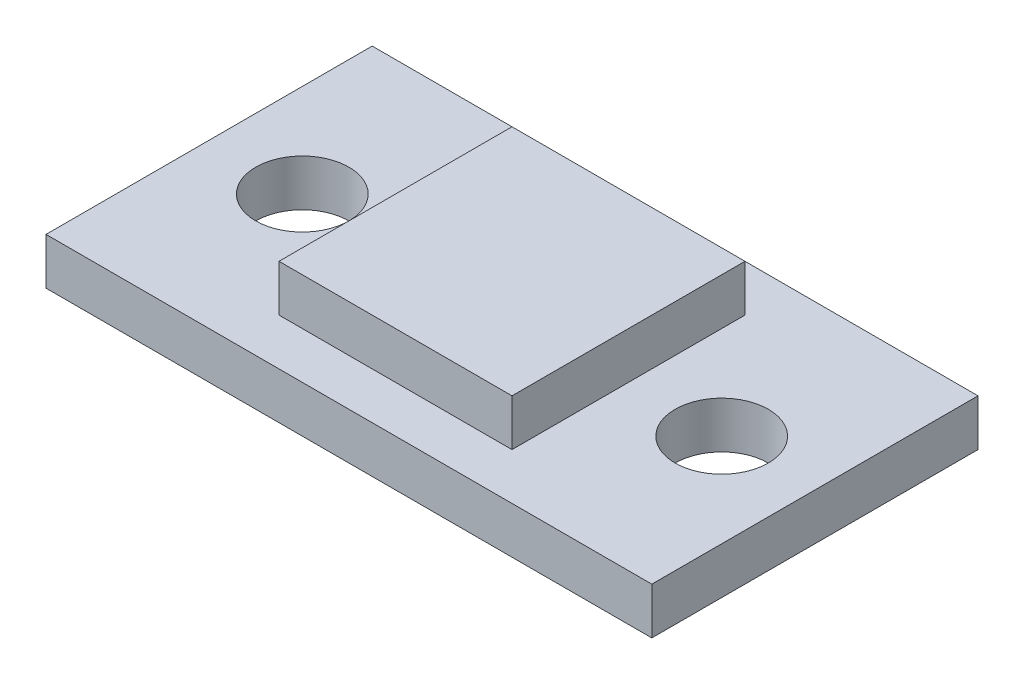
from build123d import *

# Parameters (mm, degrees)
ESQUISSE1_W        = 5
ESQUISSE1_H        = 5
BOSS_EXTRU_1_DEPTH = 1
ESQUISSE2_W        = 13
ESQUISSE2_H        = 7
ESQUISSE2_R        = 1
BOSS_EXTRU_2_DEPTH = 1


with BuildPart() as part:
    # Esquisse1 → Boss.-Extru.1 (new body)
    with BuildSketch(Plane(origin=(0, 0, 0), x_dir=(1, 0, 0), z_dir=(0, 1, 0))):
        Rectangle(ESQUISSE1_W, ESQUISSE1_H)
    extrude(amount=BOSS_EXTRU_1_DEPTH)

    # Esquisse2 → Boss.-Extru.2 (add)
    with BuildSketch(Plane.XZ):
        Rectangle(ESQUISSE2_W, ESQUISSE2_H)
        with Locations(Location((4.5, 0, 0), (0, 0, 270))):
            Circle(ESQUISSE2_R, mode=Mode.SUBTRACT)
        with Locations(Location((-4.5, 0, 0), (0, 0, 90))):
            Circle(ESQUISSE2_R, mode=Mode.SUBTRACT)
    extrude(amount=BOSS_EXTRU_2_DEPTH)


solid = part.part
